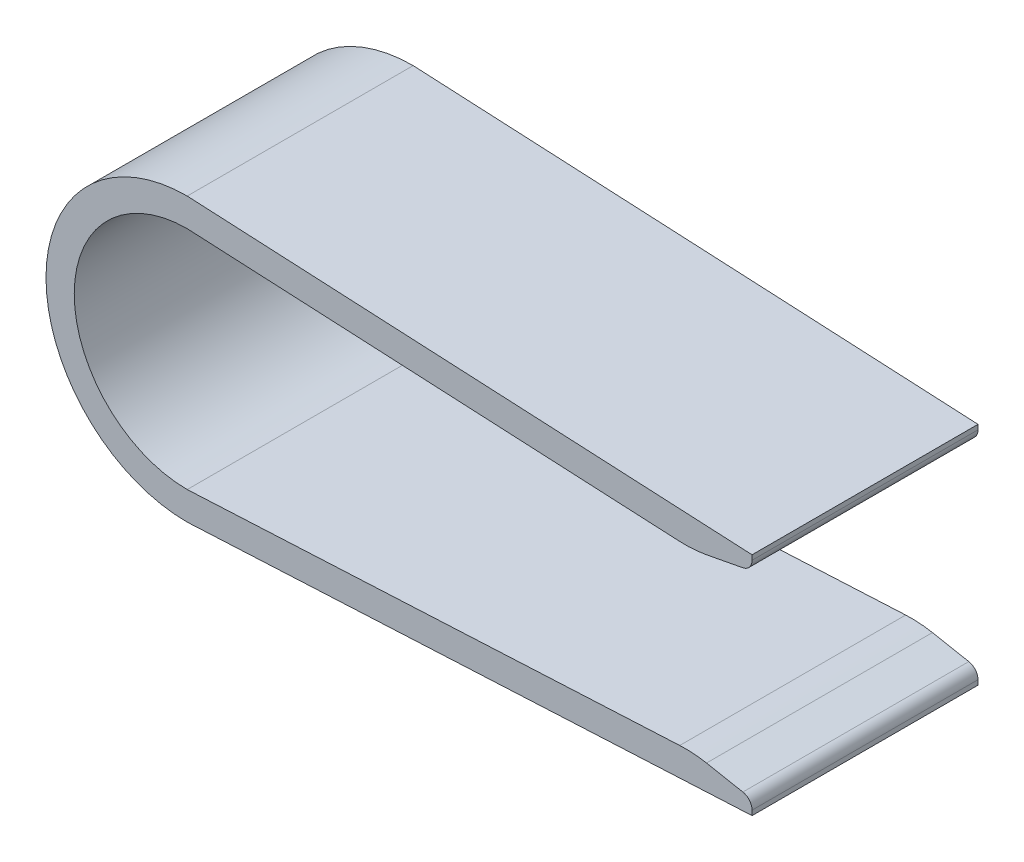
from build123d import *

# Parameters (mm, degrees)
BOSS_EXTRUDE1_DEPTH = 20
FILLET1_R           = 10
FILLET2_R           = 1


with BuildPart() as part:
    # Sketch1 → Boss-Extrude1 (new body)
    with BuildSketch(Plane.XY):
        with BuildLine():
            Line((50, 10), (50, 8.75))
            Line((50, 8.75), (44.792027113, 7.760398644))
            Line((44.792027113, 7.760398644), (0, 10))
            ThreePointArc((0, 10), (-10, 0), (0, -10))
            Line((0, -10), (44.792027113, -7.760398644))
            Line((44.792027113, -7.760398644), (50, -8.75))
            Line((50, -8.75), (50, -10))
            Line((50, -10), (0, -12.5))
            ThreePointArc((0, -12.5), (-12.5, 0), (0, 12.5))
            Line((0, 12.5), (50, 10))
        make_face()
    extrude(amount=BOSS_EXTRUDE1_DEPTH)

    # Fillet1
    fillet1_edges = [part.edges().sort_by_distance(p)[0] for p in [
        (44.792027113, 7.760398644, 10),
        (44.792027113, -7.760398644, 10),
    ]]
    fillet(fillet1_edges, radius=FILLET1_R)

    # Fillet2
    fillet2_edges = [part.edges().sort_by_distance(p)[0] for p in [
        (50, -8.75, 10),
        (50, 8.75, 10),
    ]]
    fillet(fillet2_edges, radius=FILLET2_R)


solid = part.part
